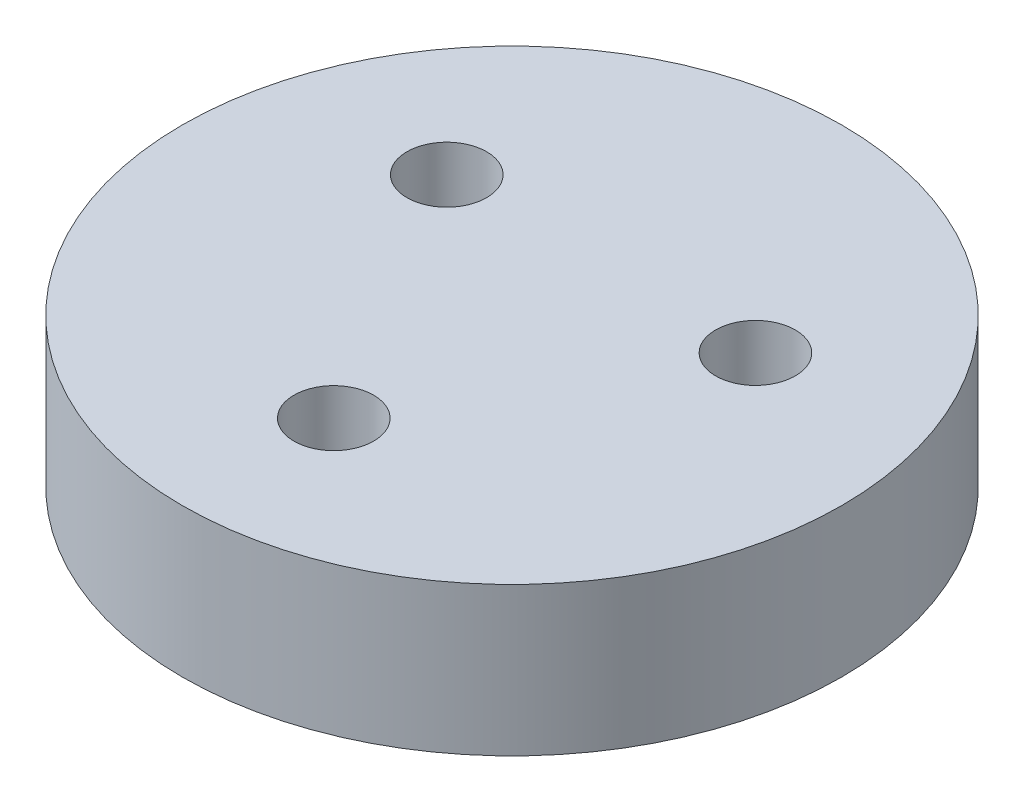
from build123d import *

# Parameters (mm, degrees)
SKETCH4_R           = 33.3
BOSS_EXTRUDE2_DEPTH = 15
SKETCH5_R           = 4.025
CUT_EXTRUDE1_DEPTH  = 50.424487858
SKETCH6_R           = 7.5
BOSS_EXTRUDE3_DEPTH = 10
FILLET1_R           = 2.5


with BuildPart() as part:
    # Sketch4 → Boss-Extrude2 (new body)
    with BuildSketch(Plane(origin=(0, 0, 0), x_dir=(1, 0, 0), z_dir=(0, 1, 0))):
        with Locations(Location((0, 0, 0), (0, 0, 270))):
            Circle(SKETCH4_R)
    extrude(amount=BOSS_EXTRUDE2_DEPTH)

    # Sketch5 → Cut-Extrude1 (cut, through all)
    with BuildSketch(Plane.XZ):
        with Locations(Location((0, 18, 0), (0, 0, 270))):
            Circle(SKETCH5_R)
        with Locations(Location((15.588457268, -9, 0), (0, 0, 270))):
            Circle(SKETCH5_R)
        with Locations(Location((-15.588457268, -9, 0), (0, 0, 270))):
            Circle(SKETCH5_R)
    extrude(amount=-CUT_EXTRUDE1_DEPTH, mode=Mode.SUBTRACT)

    # Sketch6 → Boss-Extrude3 (add)
    with BuildSketch(Plane.XZ):
        with Locations(Location((0, 0, 0), (0, 0, 90))):
            Circle(SKETCH6_R)
    extrude(amount=BOSS_EXTRUDE3_DEPTH)

    # Fillet1
    fillet1_edges = [part.edges().sort_by_distance(p)[0] for p in [
        (0, 0, -7.5),
    ]]
    fillet(fillet1_edges, radius=FILLET1_R)


solid = part.part
